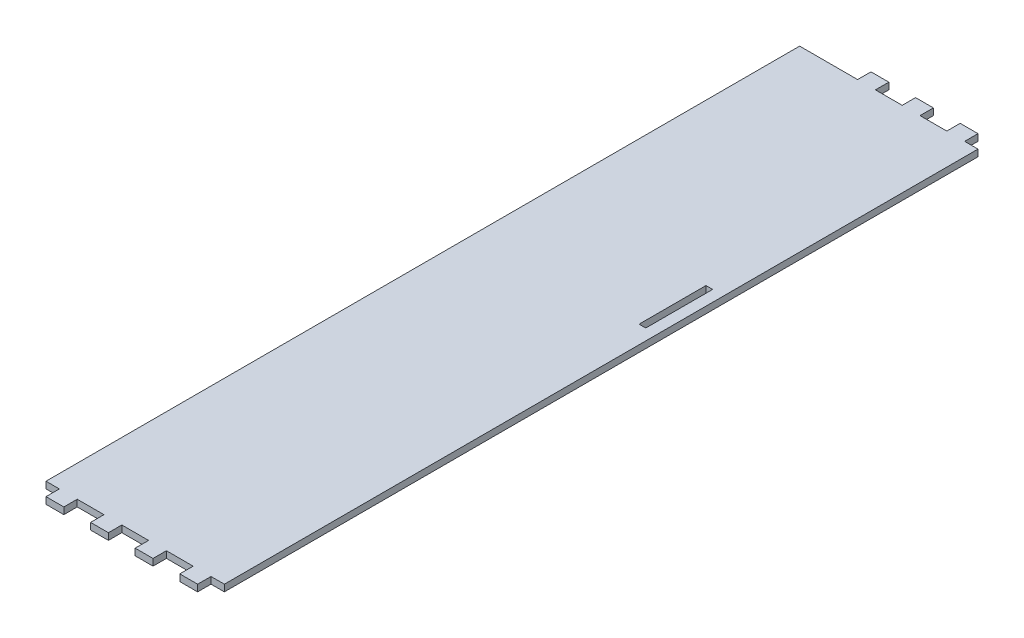
from build123d import *

# Parameters (mm, degrees)
ESQUISSE1_W             = 80
ESQUISSE1_H             = 3
BOSS_EXTRU_1_DEPTH      = 338
ESQUISSE3_W             = 8
ESQUISSE3_H             = 3
BOSS_EXTRU_2_DEPTH      = 6
ESQUISSE4_W             = 8
ESQUISSE4_H             = 6
ENL_V_MAT_EXTRU_2_DEPTH = 6
ESQUISSE5_W             = 3
ESQUISSE5_H             = 30
ENL_V_MAT_EXTRU_3_DEPTH = 3


with BuildPart() as part:
    # Esquisse1 → Boss.-Extru.1 (new body)
    with BuildSketch(Plane.XY):
        with Locations((40, 1.5)):
            Rectangle(ESQUISSE1_W, ESQUISSE1_H)
    extrude(amount=BOSS_EXTRU_1_DEPTH)

    # Esquisse3 → Boss.-Extru.2 (add)
    with BuildSketch(Plane(origin=(0, 0, 0), x_dir=(-1, 0, 0), z_dir=(0, 0, -1))):
        with Locations((-10, 1.5)):
            Rectangle(ESQUISSE3_W, ESQUISSE3_H)
        with Locations((-30, 1.5)):
            Rectangle(ESQUISSE3_W, ESQUISSE3_H)
        with Locations((-50, 1.5)):
            Rectangle(ESQUISSE3_W, ESQUISSE3_H)
        with Locations((-70, 1.5)):
            Rectangle(ESQUISSE3_W, ESQUISSE3_H)
    boss_extru_2 = extrude(amount=BOSS_EXTRU_2_DEPTH)

    # Symétrie1: Boss.-Extru.2 across plane
    add(boss_extru_2.mirror(Plane(origin=(0, 0, 169), x_dir=(1, 0, 0), z_dir=(0, 0, -1))))

    # Esquisse4 → Enlèv. mat.-Extru.2 (cut)
    with BuildSketch(Plane.XZ):
        with Locations((10, -3)):
            Rectangle(ESQUISSE4_W, ESQUISSE4_H)
    extrude(amount=-ENL_V_MAT_EXTRU_2_DEPTH, mode=Mode.SUBTRACT)

    # Esquisse5 → Enlèv. mat.-Extru.3 (cut)
    with BuildSketch(Plane.XZ):
        with Locations((73.5, 129)):
            Rectangle(ESQUISSE5_W, ESQUISSE5_H)
    extrude(amount=-ENL_V_MAT_EXTRU_3_DEPTH, mode=Mode.SUBTRACT)


solid = part.part
